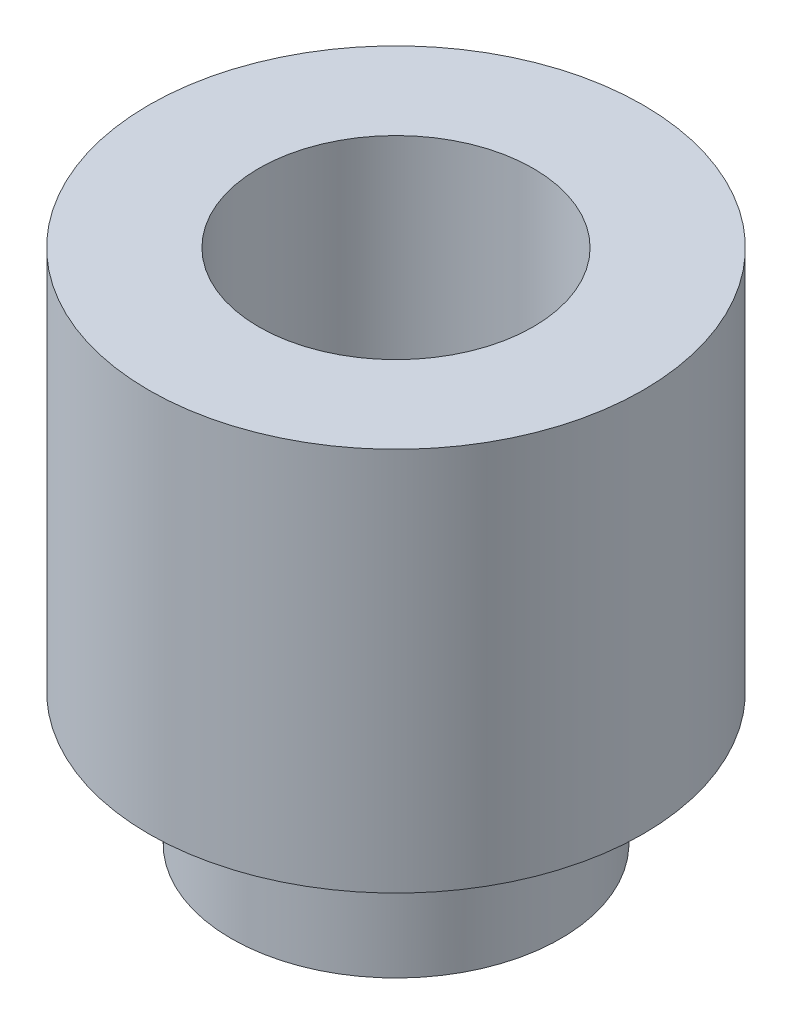
from build123d import *
from build123d.topology import SkipClean

# Parameters (mm, degrees)
SKETCH_1_R      = 2.25
SKETCH_1_R_2    = 1.25
EXTRUDE_1_DEPTH = 3.5
EXTRUDE_START   = 1.2
SKETCH_2_R      = 1.5
SKETCH_2_R_2    = 1.25
EXTRUDE_2_DEPTH = 1.2


with BuildPart() as part:
    # 草图1 → 凸台-拉伸1 (new body)
    with BuildSketch(Plane(origin=(0, 0, 0), x_dir=(1, 0, 0), z_dir=(0, 1, 0))):
        with Locations(Location((0, 0, 0), (0, 0, 270))):
            Circle(SKETCH_1_R)
        with Locations(Location((0, 0, 0), (0, 0, 270))):
            Circle(SKETCH_1_R_2, mode=Mode.SUBTRACT)
    extrude(amount=EXTRUDE_1_DEPTH)

    # 草图2 → 凸台-拉伸2 (add)
    with SkipClean():  # the faces are left unmerged after this step: merging them gives an invalid solid
        with BuildSketch(Plane.XZ.offset(EXTRUDE_START)):
            with Locations(Location((0, 0, 0), (0, 0, 90))):
                Circle(SKETCH_2_R)
            with Locations(Location((0, 0, 0), (0, 0, 270))):
                Circle(SKETCH_2_R_2, mode=Mode.SUBTRACT)
        extrude(amount=-EXTRUDE_2_DEPTH)


solid = part.part
